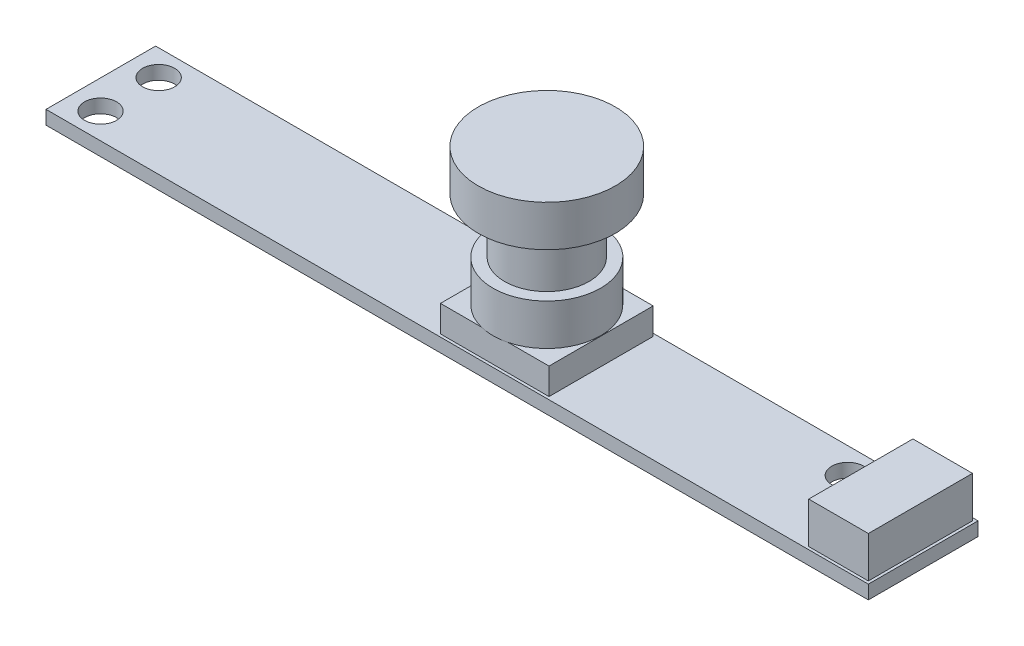
from build123d import *

# Parameters (mm, degrees)
SKETCH1_W           = 60
SKETCH1_H           = 8
BOSS_EXTRUDE1_DEPTH = 1
SKETCH2_W           = 4.35
SKETCH2_H           = 7.6
BOSS_EXTRUDE2_DEPTH = 3
SKETCH3_R           = 1.17
CUT_EXTRUDE1_DEPTH  = 3
SKETCH4_W           = 7.92
SKETCH4_H           = 7.6
BOSS_EXTRUDE3_DEPTH = 1.93
SKETCH5_R           = 3.925
BOSS_EXTRUDE4_DEPTH = 3
SKETCH6_R           = 3.08
BOSS_EXTRUDE5_DEPTH = 4
SKETCH7_R           = 5
BOSS_EXTRUDE6_DEPTH = 3


with BuildPart() as part:
    # Sketch1 → Boss-Extrude1 (new body)
    with BuildSketch(Plane(origin=(0, 0, 0), x_dir=(1, 0, 0), z_dir=(0, 1, 0))):
        with Locations((30, -4)):
            Rectangle(SKETCH1_W, SKETCH1_H)
    extrude(amount=BOSS_EXTRUDE1_DEPTH)

    # Sketch2 → Boss-Extrude2 (add)
    with BuildSketch(Plane(origin=(0, 1, 0), x_dir=(1, 0, 0), z_dir=(0, 1, 0))):
        with Locations((57.625, -4)):
            Rectangle(SKETCH2_W, SKETCH2_H)
    extrude(amount=BOSS_EXTRUDE2_DEPTH)

    # Sketch3 → Cut-Extrude1 (cut)
    with BuildSketch(Plane(origin=(0, 1, 0), x_dir=(1, 0, 0), z_dir=(0, 1, 0))):
        with Locations(Location((52.38, -1.88, 0), (0, 0, 270))):
            Circle(SKETCH3_R)
        with Locations(Location((2.1, -6.12, 0), (0, 0, 270))):
            Circle(SKETCH3_R)
        with Locations(Location((2.1, -1.88, 0), (0, 0, 270))):
            Circle(SKETCH3_R)
    extrude(amount=-CUT_EXTRUDE1_DEPTH, mode=Mode.SUBTRACT)

    # Sketch4 → Boss-Extrude3 (add)
    with BuildSketch(Plane(origin=(0, 1, 0), x_dir=(1, 0, 0), z_dir=(0, 1, 0))):
        with Locations((32.54, -4)):
            Rectangle(SKETCH4_W, SKETCH4_H)
    extrude(amount=BOSS_EXTRUDE3_DEPTH)

    # Sketch5 → Boss-Extrude4 (add)
    with BuildSketch(Plane(origin=(0, 2.93, 0), x_dir=(1, 0, 0), z_dir=(0, 1, 0))):
        with Locations(Location((32.54, -4, 0), (0, 0, 75.50119591))):
            Circle(SKETCH5_R)
    extrude(amount=BOSS_EXTRUDE4_DEPTH)

    # Sketch6 → Boss-Extrude5 (add)
    with BuildSketch(Plane(origin=(0, 5.93, 0), x_dir=(1, 0, 0), z_dir=(0, 1, 0))):
        with Locations(Location((32.54, -4, 0), (0, 0, 270))):
            Circle(SKETCH6_R)
    extrude(amount=BOSS_EXTRUDE5_DEPTH)

    # Sketch7 → Boss-Extrude6 (add)
    with BuildSketch(Plane(origin=(0, 9.93, 0), x_dir=(1, 0, 0), z_dir=(0, 1, 0))):
        with Locations(Location((32.54, -4, 0), (0, 0, 270))):
            Circle(SKETCH7_R)
    extrude(amount=BOSS_EXTRUDE6_DEPTH)


solid = part.part
